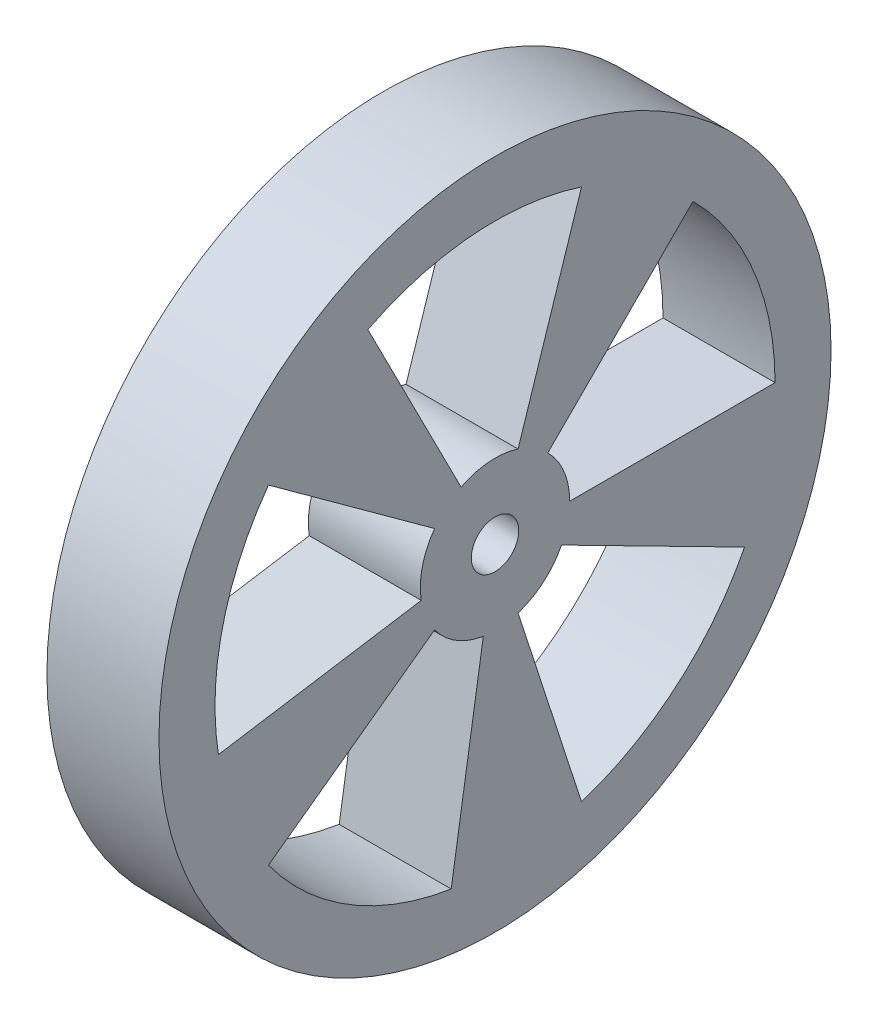
from build123d import *

# Parameters (mm, degrees)
SKETCH1_R           = 90
BOSS_EXTRUDE1_DEPTH = 30
SKETCH2_R           = 6.35
CUT_EXTRUDE2_DEPTH  = 131.766968306
CUT_EXTRUDE3_DEPTH  = 30
CIRPATTERN1_COUNT   = 5


with BuildPart() as part:
    # Sketch1 → Boss-Extrude1 (new body)
    with BuildSketch(Plane(origin=(0, 0, 0), x_dir=(0, 0, -1), z_dir=(1, 0, 0))):
        Circle(SKETCH1_R)
    extrude(amount=BOSS_EXTRUDE1_DEPTH)

    # Sketch2 → Cut-Extrude2 (cut, through all)
    with BuildSketch(Plane.ZY):
        Circle(SKETCH2_R)
    extrude(amount=-CUT_EXTRUDE2_DEPTH, mode=Mode.SUBTRACT)

    # Sketch3 → Cut-Extrude3 (cut)
    with BuildSketch(Plane.ZY):
        with BuildLine():
            Line((-20, 0), (-75, 0))
            ThreePointArc((-75, 0), (-69.290964938, 28.701257427), (-53.033008589, 53.033008589))
            Line((-53.033008589, 53.033008589), (-14.142135624, 14.142135624))
            ThreePointArc((-14.142135624, 14.142135624), (-18.47759065, 7.653668647), (-20, 0))
        make_face()
    cut_extrude3 = extrude(amount=-CUT_EXTRUDE3_DEPTH, mode=Mode.SUBTRACT)

    # CirPattern1: Cut-Extrude3 ×5 about axis
    cirpattern1_axis = Axis((0, 0, 0), (1, 0, 0))
    for i in range(1, CIRPATTERN1_COUNT):
        add(cut_extrude3.rotate(cirpattern1_axis, i * 360 / CIRPATTERN1_COUNT), mode=Mode.SUBTRACT)


solid = part.part
